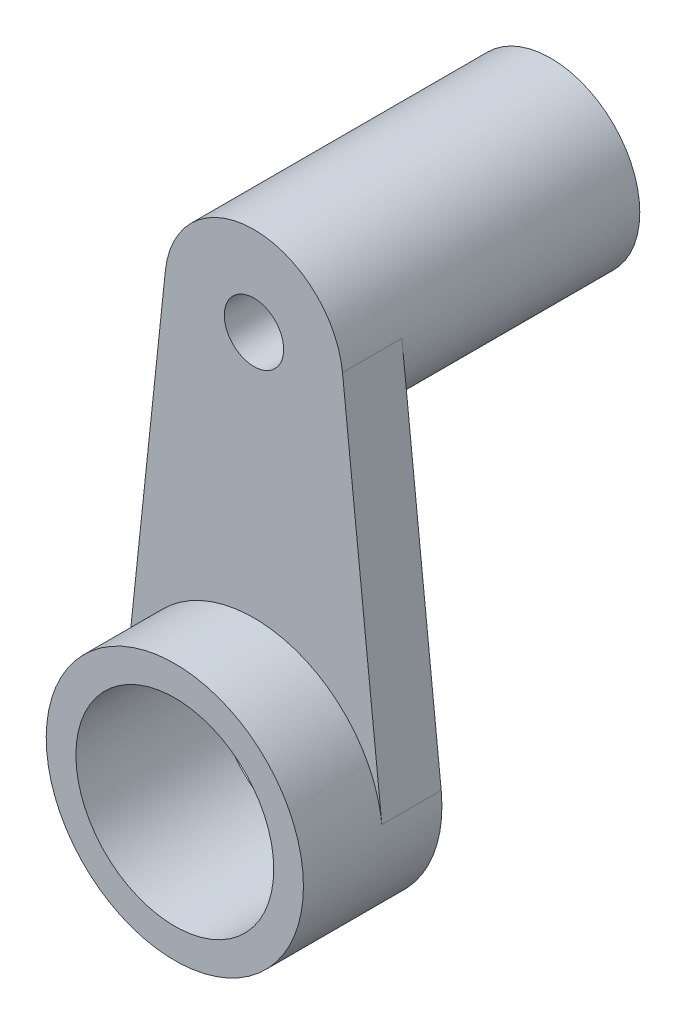
from build123d import *
from build123d.topology import SkipClean

# Parameters (mm, degrees)
BOSS_EXTRUDE1_DEPTH = 6
BOSS_EXTRUDE2_START = 6
SKETCH3_R           = 13
BOSS_EXTRUDE2_DEPTH = 8
BOSS_EXTRUDE3_START = -24
SKETCH4_R           = 9
BOSS_EXTRUDE3_DEPTH = 24
SKETCH5_R           = 10
SKETCH5_R_2         = 3
CUT_EXTRUDE1_DEPTH  = 30


with BuildPart() as part:
    # Sketch2 → Boss-Extrude1 (new body)
    with BuildSketch(Plane(origin=(0, 0, 0), x_dir=(0, 1, 0), z_dir=(0, 0, 1))):
        with BuildLine():
            Line((1.368421053, 12.927777219), (38.947368421, 8.949999613))
            ThreePointArc((38.947368421, 8.949999613), (47, 0), (38.947368421, -8.949999613))
            Line((38.947368421, -8.949999613), (1.368421053, -12.927777219))
            ThreePointArc((1.368421053, -12.927777219), (-13, 0), (1.368421053, 12.927777219))
        make_face()
    extrude(amount=BOSS_EXTRUDE1_DEPTH)

    # Sketch3 → Boss-Extrude2 (add)
    with SkipClean():  # the faces are left unmerged after this step: merging them gives an invalid solid
        with BuildSketch(Plane(origin=(0, 0, 0), x_dir=(0, 1, 0), z_dir=(0, 0, 1)).offset(BOSS_EXTRUDE2_START)):
            with Locations(Location((0, 0, 0), (0, 0, 83.957671581))):
                Circle(SKETCH3_R)
        extrude(amount=BOSS_EXTRUDE2_DEPTH)

    # Sketch4 → Boss-Extrude3 (add)
    with SkipClean():  # the faces are left unmerged after this step: merging them gives an invalid solid
        with BuildSketch(Plane(origin=(0, 0, 0), x_dir=(0, 1, 0), z_dir=(0, 0, 1)).offset(BOSS_EXTRUDE3_START)):
            with Locations(Location((38, 0, 0), (0, 0, 83.957671581))):
                Circle(SKETCH4_R)
        extrude(amount=BOSS_EXTRUDE3_DEPTH)

    # Sketch5 → Cut-Extrude1 (cut, symmetric)
    with SkipClean():  # the faces are left unmerged after this step: merging them gives an invalid solid
        with BuildSketch(Plane(origin=(0, 0, 0), x_dir=(0, 1, 0), z_dir=(0, 0, 1))):
            with Locations(Location((0, 0, 0), (0, 0, 270))):
                Circle(SKETCH5_R)
            with Locations(Location((38, 0, 0), (0, 0, 270))):
                Circle(SKETCH5_R_2)
        extrude(amount=CUT_EXTRUDE1_DEPTH, both=True, mode=Mode.SUBTRACT)


solid = part.part
